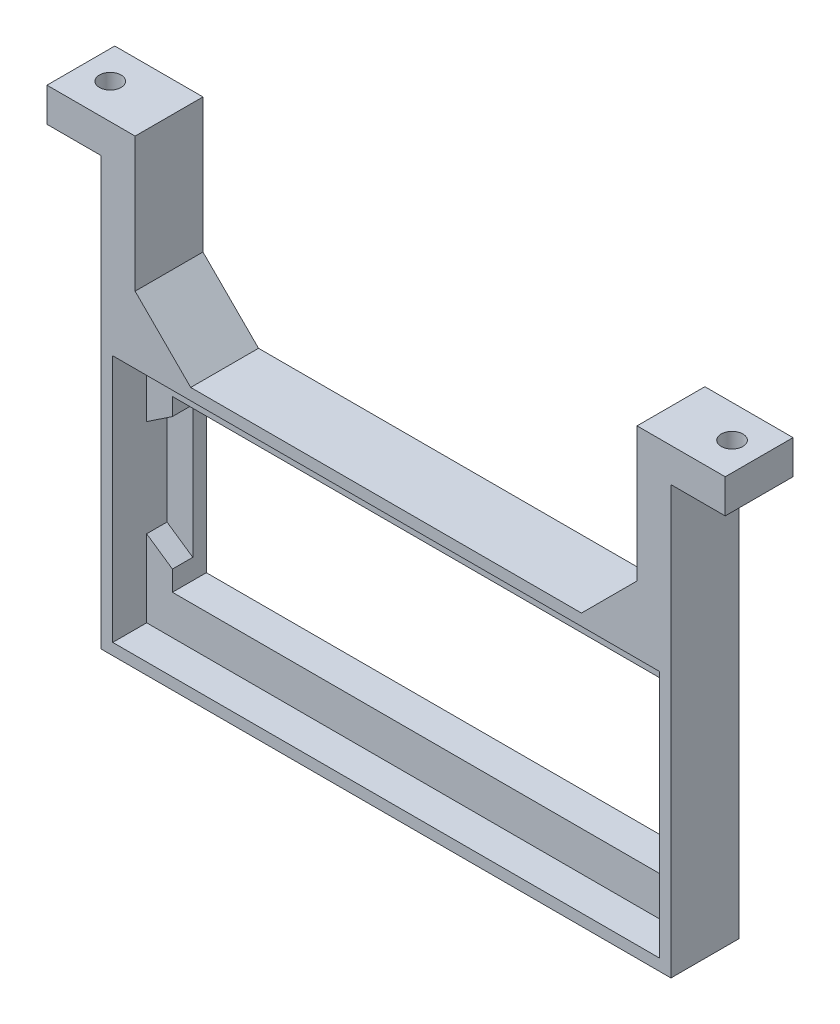
from build123d import *

# Parameters (mm, degrees)
EXTRUDE_1_DEPTH     = 10
SKETCH_2_W          = 80.6
SKETCH_2_H          = 36.6
CUT_EXTRUDE_1_DEPTH = 5
SKETCH_3_W          = 73
SKETCH_3_H          = 25
CUT_EXTRUDE_2_DEPTH = 115.512008104
CUT_EXTRUDE_3_DEPTH = 3
SKETCH_5_R          = 1.6
CUT_EXTRUDE_4_DEPTH = 112.950882087


with BuildPart() as part:
    # 草图1 → 凸台-拉伸1 (new body)
    with BuildSketch(Plane.XY):
        Polygon((0, 40), (0, 63), (-8, 63), (-8, 68), (5, 68), (5, 48.19405544), (13.19405544, 40), (70.80594456, 40), (79, 48.19405544), (79, 68), (92, 68), (92, 63), (84, 63), (84, 40), (84, 0), (0, 0), align=None)
    extrude(amount=EXTRUDE_1_DEPTH)

    # 草图2 → 切除-拉伸1 (cut)
    with BuildSketch(Plane.XY.offset(10)):
        with Locations((42, 20)):
            Rectangle(SKETCH_2_W, SKETCH_2_H)
    extrude(amount=-CUT_EXTRUDE_1_DEPTH, mode=Mode.SUBTRACT)

    # 草图3 → 切除-拉伸2 (cut, through all)
    with BuildSketch(Plane.XY.offset(5)):
        with Locations((42, 20)):
            Rectangle(SKETCH_3_W, SKETCH_3_H)
    extrude(amount=-CUT_EXTRUDE_2_DEPTH, mode=Mode.SUBTRACT)

    # 草图4 → 切除-拉伸3 (cut)
    with BuildSketch(Plane.XY.offset(5)):
        Polygon((77.017311929, 30.931067044), (82.3, 27.389990557), (82.3, 13.068303431), (77.017311929, 9.448536355), align=None)
        Polygon((6.982688071, 9.448536355), (6.982688071, 30.931067044), (1.7, 27.389990557), (1.7, 13.068303431), align=None)
    extrude(amount=-CUT_EXTRUDE_3_DEPTH, mode=Mode.SUBTRACT)

    # 草图5 → 切除-拉伸4 (cut, through all)
    with BuildSketch(Plane.XZ.offset(-63)):
        with Locations(Location((87.837450425, 4.830878187, 0), (0, 0, 270))):
            Circle(SKETCH_5_R)
        with Locations(Location((-3.837450425, 4.830878187, 0), (0, 0, 90))):
            Circle(SKETCH_5_R)
    extrude(amount=-CUT_EXTRUDE_4_DEPTH, mode=Mode.SUBTRACT)


solid = part.part
